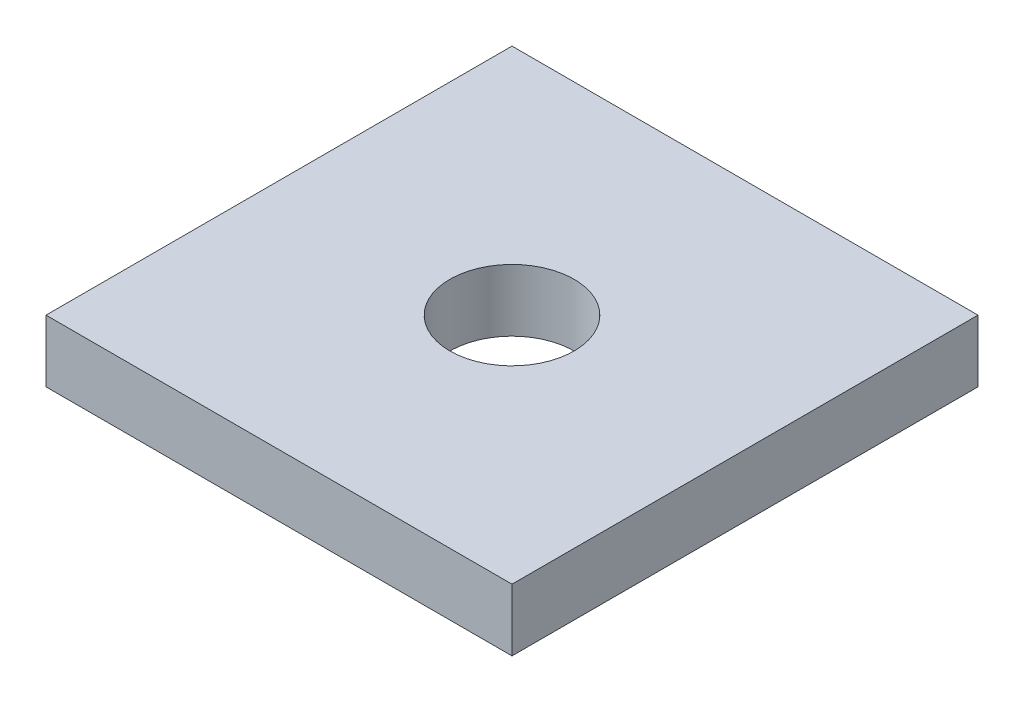
from build123d import *

# Parameters (mm, degrees)
SKETCH1_W           = 38.1
SKETCH1_H           = 38.1
BOSS_EXTRUDE1_DEPTH = 5.08
SKETCH2_R           = 5.08
CUT_EXTRUDE1_DEPTH  = 5.08


with BuildPart() as part:
    # Sketch1 → Boss-Extrude1 (new body)
    with BuildSketch(Plane(origin=(0, 0, 0), x_dir=(1, 0, 0), z_dir=(0, 1, 0))):
        Rectangle(SKETCH1_W, SKETCH1_H)
    extrude(amount=BOSS_EXTRUDE1_DEPTH)

    # Sketch2 → Cut-Extrude1 (cut)
    with BuildSketch(Plane(origin=(0, 5.08, 0), x_dir=(1, 0, 0), z_dir=(0, 1, 0))):
        with Locations(Location((0, 0, 0), (0, 0, 270))):
            Circle(SKETCH2_R)
    extrude(amount=-CUT_EXTRUDE1_DEPTH, mode=Mode.SUBTRACT)


solid = part.part
